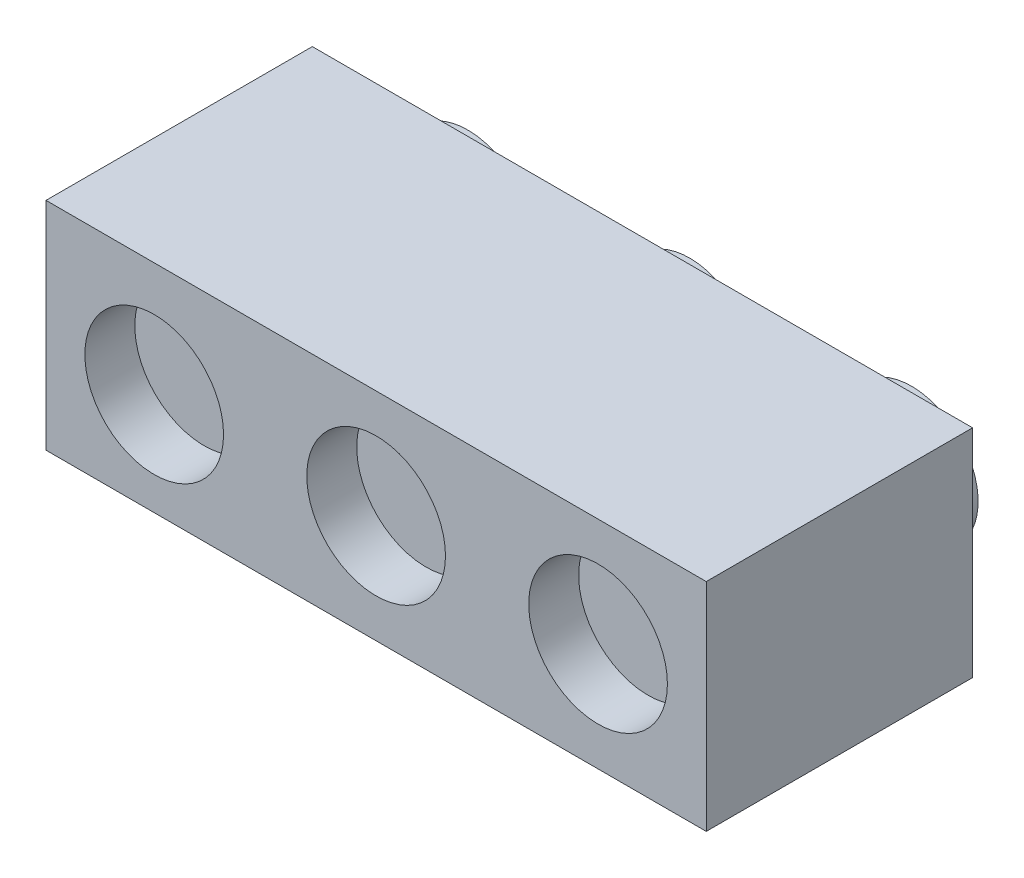
from build123d import *

# Parameters (mm, degrees)
SKETCH_1_W          = 23.8
SKETCH_1_H          = 7.8
EXTRUDE_1_DEPTH     = 9.6
SKETCH_2_R          = 2.4
EXTRUDE_2_DEPTH     = 1.7
SKETCH_3_R          = 2.5
CUT_EXTRUDE_1_DEPTH = 1.8


with BuildPart() as part:
    # Эскиз1 → Бобышка-Вытянуть1 (new body)
    with BuildSketch(Plane.XY):
        Rectangle(SKETCH_1_W, SKETCH_1_H)
    extrude(amount=EXTRUDE_1_DEPTH)

    # Эскиз2 → Бобышка-Вытянуть2 (add)
    with BuildSketch(Plane(origin=(0, 0, 0), x_dir=(-1, 0, 0), z_dir=(0, 0, -1))):
        Circle(SKETCH_2_R)
        with Locations((8, 0)):
            Circle(SKETCH_2_R)
        with Locations((-8, 0)):
            Circle(SKETCH_2_R)
    extrude(amount=EXTRUDE_2_DEPTH)

    # Эскиз3 → Вырез-Вытянуть1 (cut)
    with BuildSketch(Plane.XY.offset(9.6)):
        Circle(SKETCH_3_R)
        with Locations((-8, -0.211129939)):
            Circle(SKETCH_3_R)
        with Locations((8, 0)):
            Circle(SKETCH_3_R)
    extrude(amount=-CUT_EXTRUDE_1_DEPTH, mode=Mode.SUBTRACT)


solid = part.part
